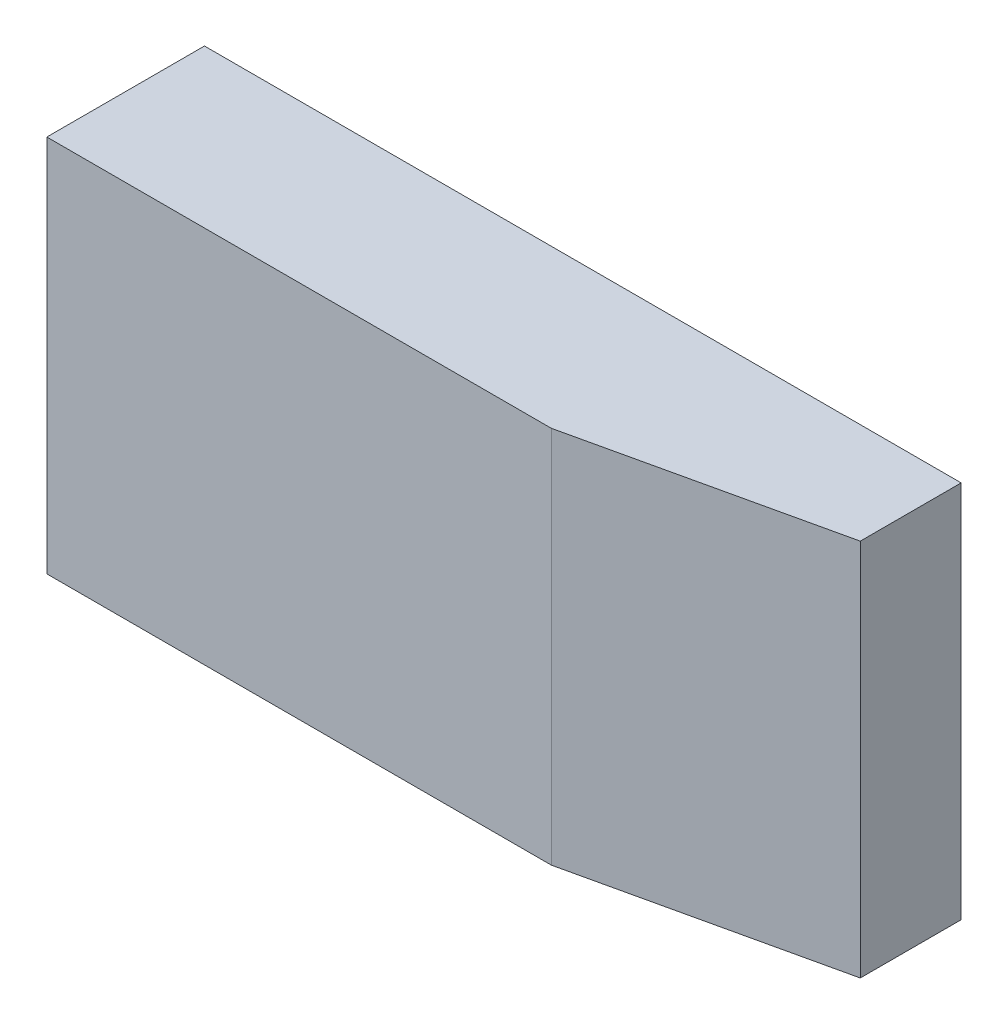
from build123d import *

# Parameters (mm, degrees)
BOSS_EXTRUDE1_DEPTH = 30


with BuildPart() as part:
    # Sketch1 → Boss-Extrude1 (new body)
    with BuildSketch(Plane(origin=(0, 0, 0), x_dir=(-1, 0, 0), z_dir=(0, 1, 0))):
        Polygon((0, 0), (0, 8), (20, 12.5), (60, 12.5), (60, 0), align=None)
    extrude(amount=BOSS_EXTRUDE1_DEPTH)


solid = part.part
